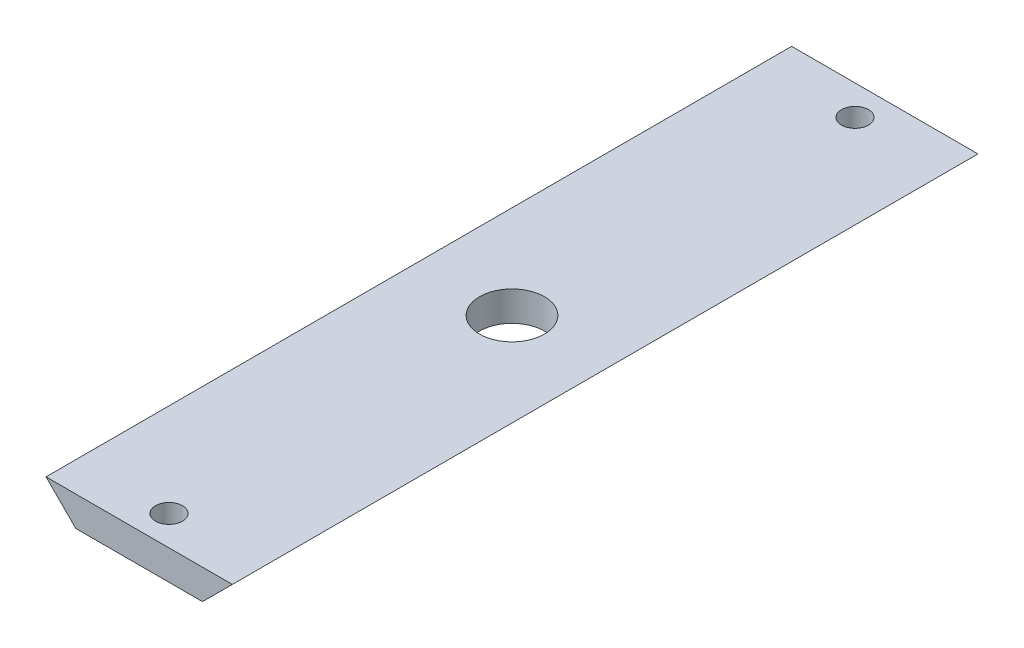
from build123d import *

# Parameters (mm, degrees)
BOSS_EXTRUDE1_DEPTH      = 39.6875
SKETCH2_R                = 1.4351
CUT_EXTRUDE1_DEPTH       = 42.03119412
F_5_16_24_TAPPED_HOLE1_D = 6.9088


with BuildPart() as part:
    # Sketch1 → Boss-Extrude1 (new body)
    with BuildSketch(Plane.XY):
        Polygon((0, 0), (9.9187, 0), (6.7437, -3.175), (0, -3.175), align=None)
    extrude(amount=BOSS_EXTRUDE1_DEPTH)

    # Mirror1: part across plane


with BuildPart() as part_1:
    add(part.part)
    add(part.part.mirror(Plane(origin=(0, -3.175, 39.6875), x_dir=(0, 0, 1), z_dir=(1, 0, 0))))

    # Sketch2 → Cut-Extrude1 (cut, through all)
    with BuildSketch(Plane(origin=(0, 0, 0), x_dir=(1, 0, 0), z_dir=(0, 1, 0))):
        with Locations(Location((0, -36.5125, 0), (0, 0, 180))):
            Circle(SKETCH2_R)
    extrude(amount=-CUT_EXTRUDE1_DEPTH, mode=Mode.SUBTRACT)

    # Mirror2: part across plane


with BuildPart() as part_2:
    add(part_1.part)
    add(part_1.part.mirror(Plane(origin=(0, 0, 0), x_dir=(1, 0, 0), z_dir=(0, 0, -1))))

    # 5/16-24 Tapped Hole1 (through all)
    with Locations(Plane(origin=(0, 0, 0), x_dir=(-1, 0, 0), z_dir=(0, 1, 0))):
        with Locations((0, 0)):
            Hole(F_5_16_24_TAPPED_HOLE1_D / 2)


solid = part_2.part
